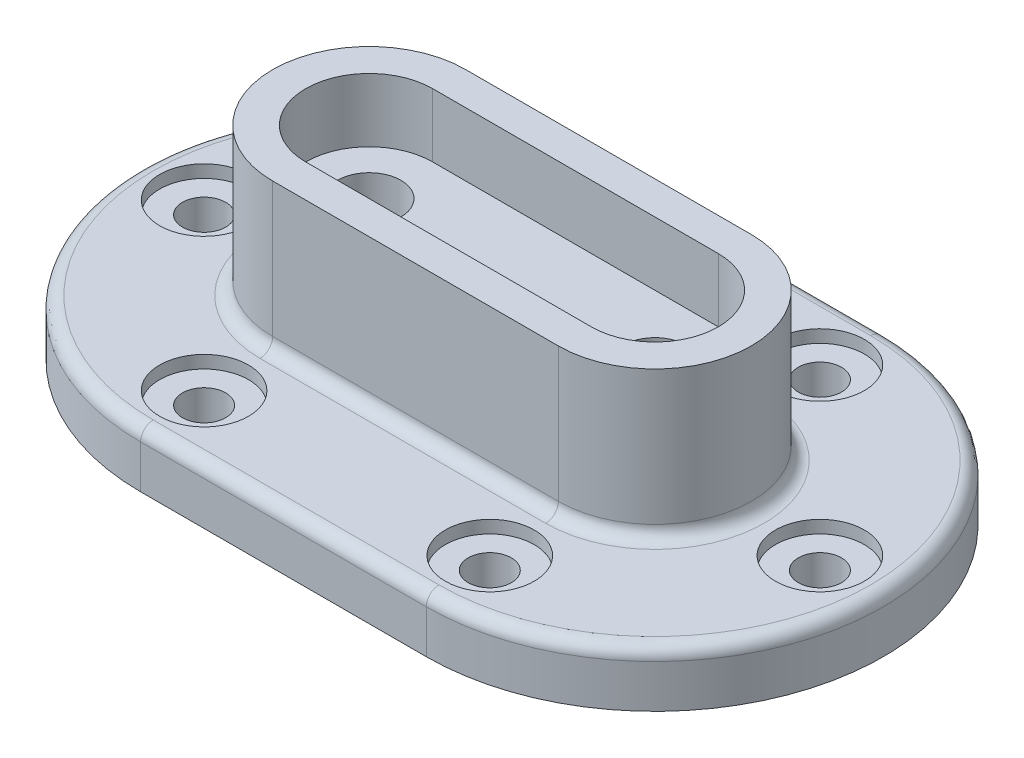
from build123d import *

# Parameters (mm, degrees)
BOSS_EXTRUDE1_DEPTH = 4.4
SKETCH2_R           = 3.5
CUT_EXTRUDE1_DEPTH  = 1
SKETCH2_3_R         = 1.7
CUT_EXTRUDE2_DEPTH  = 35.625460286
BOSS_EXTRUDE2_DEPTH = 11.6
FILLET1_R           = 1
CUT_EXTRUDE3_DEPTH  = 5
SKETCH5_R           = 2.5
CUT_EXTRUDE4_DEPTH  = 11


with BuildPart() as part:
    # Sketch1 → Boss-Extrude1 (new body)
    with BuildSketch(Plane(origin=(0, 0, 0), x_dir=(1, 0, 0), z_dir=(0, 1, 0))):
        with BuildLine():
            Line((-11.25, 18), (11.25, 18))
            ThreePointArc((11.25, 18), (29.25, 0), (11.25, -18))
            Line((11.25, -18), (-11.25, -18))
            ThreePointArc((-11.25, -18), (-29.25, 0), (-11.25, 18))
        make_face()
    extrude(amount=BOSS_EXTRUDE1_DEPTH)

    # Sketch2 → Cut-Extrude1 (cut)
    with BuildSketch(Plane(origin=(0, 4.4, 0), x_dir=(1, 0, 0), z_dir=(0, 1, 0))):
        with Locations(Location((-24.25, 0, 0), (0, 0, 270))):
            Circle(SKETCH2_R)
        with Locations(Location((-11.25, 13, 0), (0, 0, 270))):
            Circle(SKETCH2_R)
        with Locations(Location((11.25, 13, 0), (0, 0, 270))):
            Circle(SKETCH2_R)
        with Locations(Location((24.25, 0, 0), (0, 0, 270))):
            Circle(SKETCH2_R)
        with Locations(Location((11.25, -13, 0), (0, 0, 270))):
            Circle(SKETCH2_R)
        with Locations(Location((-11.25, -13, 0), (0, 0, 270))):
            Circle(SKETCH2_R)
    extrude(amount=-CUT_EXTRUDE1_DEPTH, mode=Mode.SUBTRACT)

    # Sketch2<3> → Cut-Extrude2 (cut, through all)
    with BuildSketch(Plane(origin=(0, 4.4, 0), x_dir=(1, 0, 0), z_dir=(0, 1, 0))):
        with Locations(Location((-11.25, 13, 0), (0, 0, 270))):
            Circle(SKETCH2_3_R)
        with Locations(Location((-24.25, 0, 0), (0, 0, 270))):
            Circle(SKETCH2_3_R)
        with Locations(Location((-11.25, -13, 0), (0, 0, 270))):
            Circle(SKETCH2_3_R)
        with Locations(Location((11.25, -13, 0), (0, 0, 270))):
            Circle(SKETCH2_3_R)
        with Locations(Location((24.25, 0, 0), (0, 0, 270))):
            Circle(SKETCH2_3_R)
        with Locations(Location((11.25, 13, 0), (0, 0, 270))):
            Circle(SKETCH2_3_R)
    extrude(amount=-CUT_EXTRUDE2_DEPTH, mode=Mode.SUBTRACT)

    # Sketch3 → Boss-Extrude2 (add)
    with BuildSketch(Plane(origin=(0, 4.4, 0), x_dir=(1, 0, 0), z_dir=(0, 1, 0))):
        with BuildLine():
            Line((-11.25, 7.6), (11.25, 7.6))
            ThreePointArc((11.25, 7.6), (18.85, 0), (11.25, -7.6))
            Line((11.25, -7.6), (-11.25, -7.6))
            ThreePointArc((-11.25, -7.6), (-18.85, 0), (-11.25, 7.6))
        make_face()
    extrude(amount=BOSS_EXTRUDE2_DEPTH)

    # Fillet1
    fillet1_edges = [part.edges().sort_by_distance(p)[0] for p in [
        (29.25, 4.4, 0),
        (0, 4.4, -18),
        (-29.25, 4.4, 0),
        (-18.85, 4.4, 0),
        (0, 4.4, 7.6),
        (18.85, 4.4, 0),
        (0, 4.4, -7.6),
        (0, 4.4, 18),
    ]]
    fillet(fillet1_edges, radius=FILLET1_R)

    # Sketch4 → Cut-Extrude3 (cut)
    with BuildSketch(Plane(origin=(0, 16, 0), x_dir=(1, 0, 0), z_dir=(0, 1, 0))):
        with BuildLine():
            Line((-11.25, 5), (11.25, 5))
            ThreePointArc((11.25, 5), (16.25, 0), (11.25, -5))
            Line((11.25, -5), (-11.25, -5))
            ThreePointArc((-11.25, -5), (-16.25, 0), (-11.25, 5))
        make_face()
    extrude(amount=-CUT_EXTRUDE3_DEPTH, mode=Mode.SUBTRACT)

    # Sketch5 → Cut-Extrude4 (cut)
    with BuildSketch(Plane(origin=(0, 11, 0), x_dir=(1, 0, 0), z_dir=(0, 1, 0))):
        with Locations(Location((-11.25, 0, 0), (0, 0, 270))):
            Circle(SKETCH5_R)
        with Locations(Location((11.25, 0, 0), (0, 0, 270))):
            Circle(SKETCH5_R)
    extrude(amount=-CUT_EXTRUDE4_DEPTH, mode=Mode.SUBTRACT)


solid = part.part
